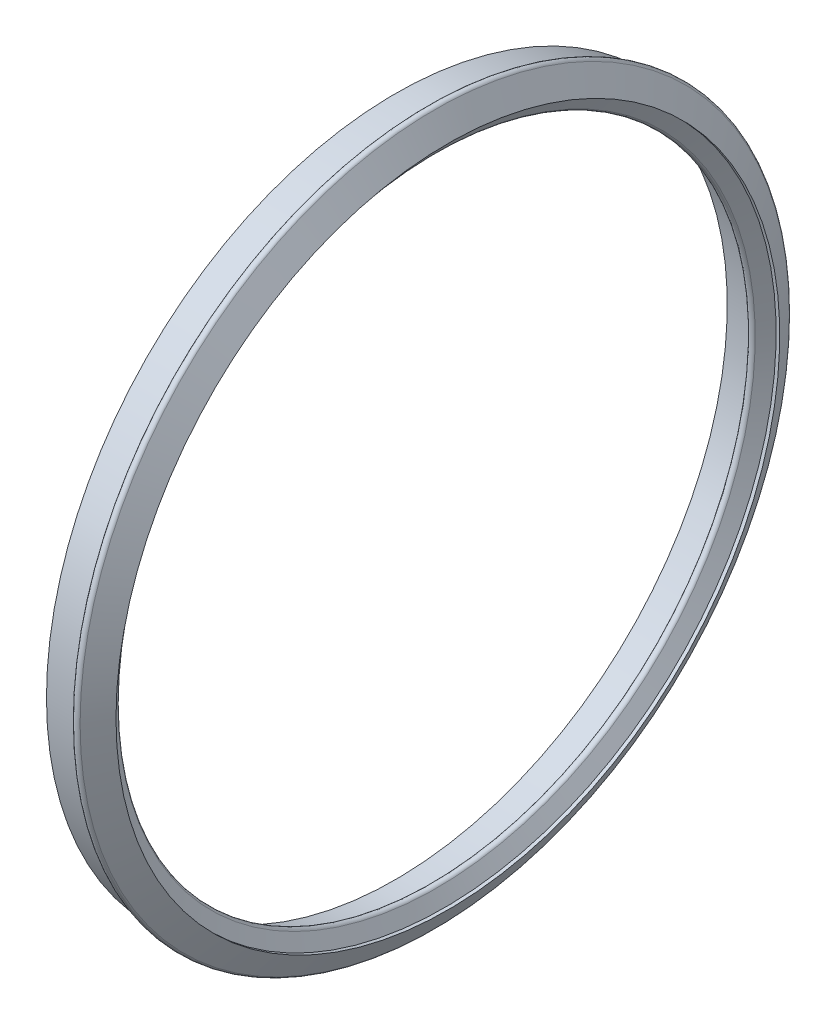
from build123d import *


with BuildPart() as part:
    # Эскиз1 → Повернуть1 (revolve)
    with BuildSketch(Plane.XY, mode=Mode.PRIVATE) as revolve_1_sk:
        with BuildLine():
            Line((0, 18.4), (1.553589838, 18.4))
            Line((1.553589838, 18.4), (1.726794919, 18.7))
            ThreePointArc((1.726794919, 18.7), (1.9, 18.8), (2.073205081, 18.7))
            Line((2.073205081, 18.7), (2.766025404, 17.5))
            Line((2.766025404, 17.5), (2.577350269, 17.5))
            Line((2.577350269, 17.5), (2.173205081, 16.8))
            ThreePointArc((2.173205081, 16.8), (2, 16.7), (1.826794919, 16.8))
            Line((1.826794919, 16.8), (1.422649731, 17.5))
            Line((1.422649731, 17.5), (0, 17.5))
            Line((0, 17.5), (0, 18.4))
        make_face()
    revolve(revolve_1_sk.sketch.rotate(Axis((0, 0, 0), (1, 0, 0)), 90), axis=Axis((0, 0, 0), (1, 0, 0)))


solid = part.part
